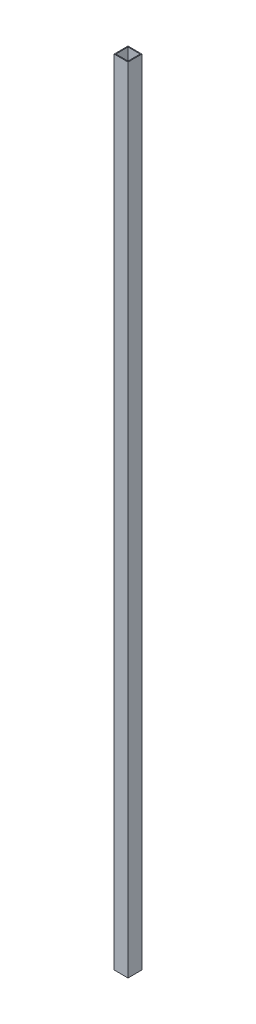
from build123d import *

# Parameters (mm, degrees)
SKETCH1_W           = 25.4
SKETCH1_H           = 25.4
SKETCH1_W_2         = 22.225
SKETCH1_H_2         = 22.225
BOSS_EXTRUDE1_DEPTH = 1447.8


with BuildPart() as part:
    # Sketch1 → Boss-Extrude1 (new body)
    with BuildSketch(Plane(origin=(0, 0, 0), x_dir=(1, 0, 0), z_dir=(0, 1, 0))):
        Rectangle(SKETCH1_W, SKETCH1_H)
        Rectangle(SKETCH1_W_2, SKETCH1_H_2, mode=Mode.SUBTRACT)
    extrude(amount=BOSS_EXTRUDE1_DEPTH)


solid = part.part
